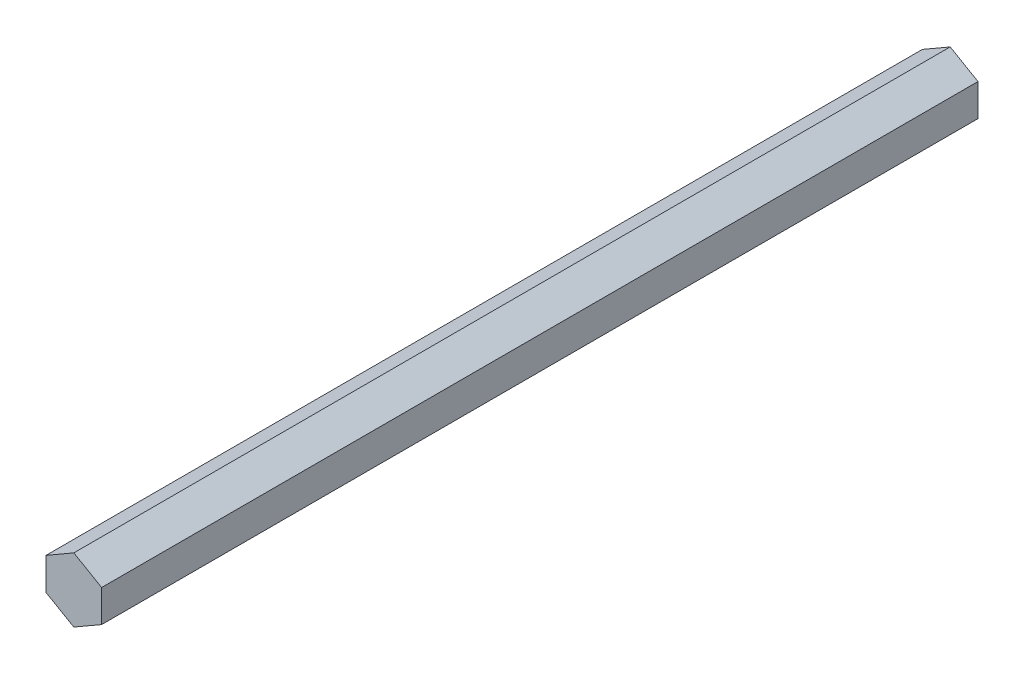
from build123d import *

# Parameters (mm, degrees)
BOSS_EXTRUDE1_DEPTH = 100


with BuildPart() as part:
    # Sketch1 → Boss-Extrude1 (new, symmetric)
    with BuildSketch(Plane.XY):
        Polygon((6.35, 3.666174209), (0, 7.332348419), (-6.35, 3.666174209), (-6.35, -3.666174209), (0, -7.332348419), (6.35, -3.666174209), align=None)
    extrude(amount=BOSS_EXTRUDE1_DEPTH, both=True)


solid = part.part
